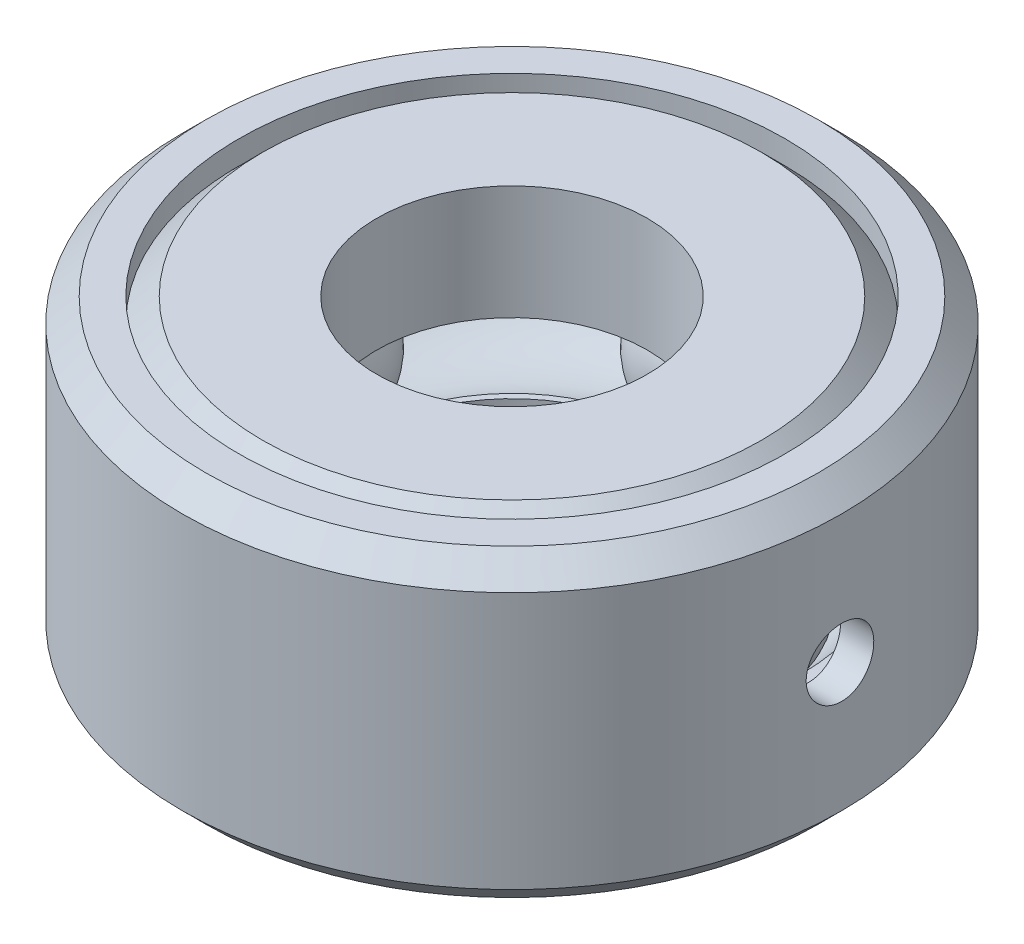
from build123d import *

# Parameters (mm, degrees)
CIRPATTERN1_COUNT  = 4
CIRPATTERN1_ANGLE  = 270
SKETCH5_R          = 1.5875
CUT_EXTRUDE1_DEPTH = 24.025591656


with BuildPart() as part:
    # Sketch1 → Revolve1 (revolve)
    with BuildSketch(Plane(origin=(0, 0, 0), x_dir=(0, 0, -1), z_dir=(1, 0, 0))):
        with BuildLine():
            Line((-11.711033898, 7.14375), (-6.35, 7.14375))
            Line((-6.35, 7.14375), (-6.35, 1.7859375))
            Line((-6.35, 1.7859375), (-7.046821761, 1.7859375))
            ThreePointArc((-7.046821761, 1.7859375), (-10.14015625, 3.571875), (-13.233490739, 1.7859375))
            Line((-13.233490739, 1.7859375), (-13.9303125, 1.7859375))
            Line((-13.9303125, 1.7859375), (-13.9303125, 4.924471398))
            Line((-13.9303125, 4.924471398), (-11.711033898, 7.14375))
        make_face()
        with BuildLine():
            Line((-6.7437, -7.14375), (-6.7437, -1.7859375))
            Line((-6.7437, -1.7859375), (-7.046821761, -1.7859375))
            ThreePointArc((-7.046821761, -1.7859375), (-10.14015625, -3.571875), (-13.233490739, -1.7859375))
            Line((-13.233490739, -1.7859375), (-13.9303125, -1.7859375))
            Line((-13.9303125, -1.7859375), (-13.9303125, -4.924471398))
            Line((-13.9303125, -4.924471398), (-11.711033898, -7.14375))
            Line((-11.711033898, -7.14375), (-6.7437, -7.14375))
        make_face()
    revolve(axis=Axis((0, -7.14375, 0), (0, 1, 0)))


with BuildPart() as body_2:
    # Sketch3 → Revolve2 (revolve)
    with BuildSketch(Plane(origin=(0, 0, 0), x_dir=(0, 0, -1), z_dir=(1, 0, 0))):
        with BuildLine():
            Line((-10.14015625, 3.571875), (-10.14015625, -3.571875))
            ThreePointArc((-10.14015625, -3.571875), (-13.71203125, 0), (-10.14015625, 3.571875))
        make_face()
    revolve(axis=Axis((0, 3.571875, 10.14015625), (0, -1, 0)))


with BuildPart() as cirpattern1_1:
    # CirPattern1: pattern copy
    add(body_2.part.rotate(Axis((0, 7.14375, 0), (0, -1, 0)), 1 * CIRPATTERN1_ANGLE / (CIRPATTERN1_COUNT - 1)))


with BuildPart() as cirpattern1_2:
    # CirPattern1: pattern copy
    add(body_2.part.rotate(Axis((0, 7.14375, 0), (0, -1, 0)), 2 * CIRPATTERN1_ANGLE / (CIRPATTERN1_COUNT - 1)))


with BuildPart() as cirpattern1_3:
    # CirPattern1: pattern copy
    add(body_2.part.rotate(Axis((0, 7.14375, 0), (0, -1, 0)), 3 * CIRPATTERN1_ANGLE / (CIRPATTERN1_COUNT - 1)))


with BuildPart() as body_6:
    # Sketch4 → Revolve3 (revolve)
    with BuildSketch(Plane(origin=(0, 0, 0), x_dir=(0, 0, -1), z_dir=(1, 0, 0))):
        Polygon((-12.820673199, 7.14375), (-14.368485699, 7.14375), (-15.478125, 6.034110699), (-15.478125, -6.034110699), (-14.368485699, -7.14375), (-12.820673199, -7.14375), (-12.820673199, -6.034110699), (-13.9303125, -4.924471398), (-13.9303125, 4.924471398), (-12.820673199, 6.034110699), align=None)
    revolve(axis=Axis((0, -7.14375, 0), (0, 1, 0)))

    # Sketch5 → Cut-Extrude1 (cut, through all)
    with BuildSketch(Plane(origin=(0, 0, 0), x_dir=(0, 0, -1), z_dir=(1, 0, 0))):
        Circle(SKETCH5_R)
    extrude(amount=CUT_EXTRUDE1_DEPTH, mode=Mode.SUBTRACT)


solid = Compound([part.part, body_2.part, cirpattern1_1.part, cirpattern1_2.part, cirpattern1_3.part, body_6.part])
